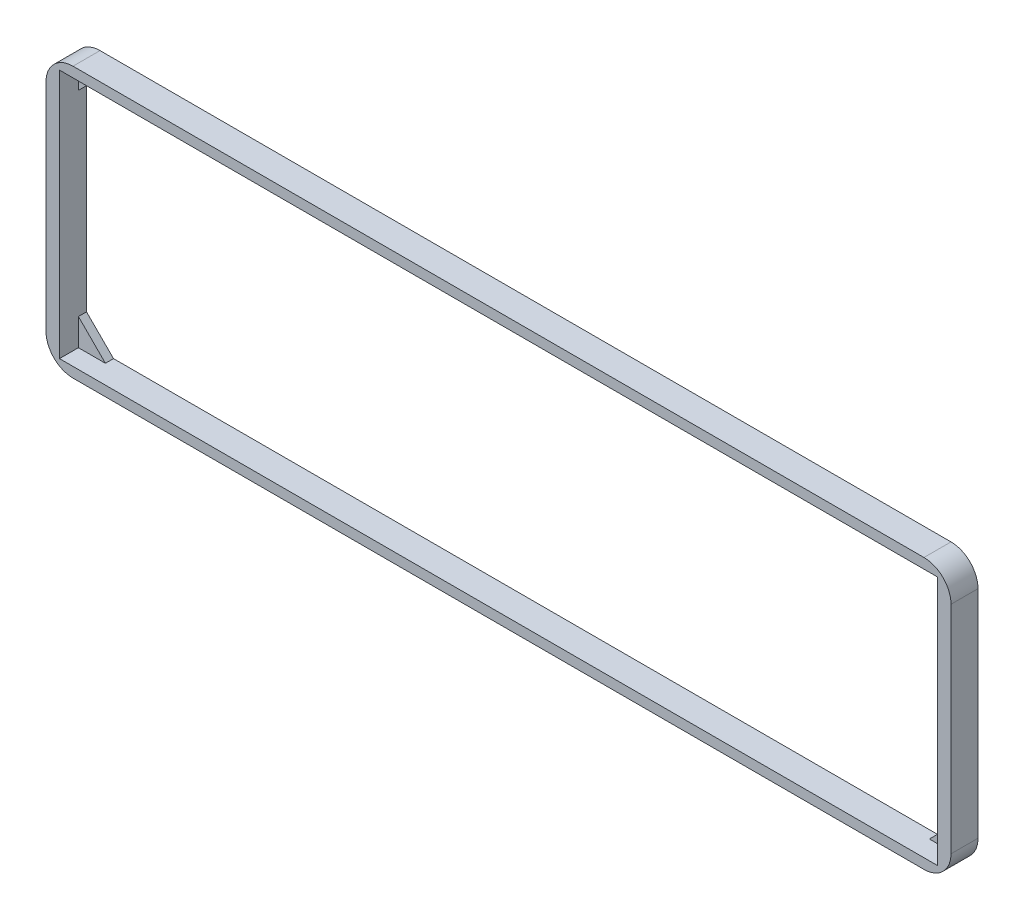
from build123d import *

# Parameters (mm, degrees)
SKETCH1_W           = 335
SKETCH1_H           = 100
SKETCH1_W_2         = 325
SKETCH1_H_2         = 92.5
BOSS_EXTRUDE1_DEPTH = 10
FILLET1_R           = 10
BOSS_EXTRUDE2_DEPTH = 3


with BuildPart() as part:
    # Sketch1 → Boss-Extrude1 (new body)
    with BuildSketch(Plane.XY):
        Rectangle(SKETCH1_W, SKETCH1_H)
        Rectangle(SKETCH1_W_2, SKETCH1_H_2, mode=Mode.SUBTRACT)
    extrude(amount=-BOSS_EXTRUDE1_DEPTH)

    # Fillet1
    fillet1_edges = [part.edges().sort_by_distance(p)[0] for p in [
        (167.5, -50, -5),
        (-167.5, -50, -5),
        (-167.5, 50, -5),
        (167.5, 50, -5),
    ]]
    fillet(fillet1_edges, radius=FILLET1_R)

    # Sketch2 → Boss-Extrude2 (add)
    with BuildSketch(Plane(origin=(0, 0, -10), x_dir=(-1, 0, 0), z_dir=(0, 0, -1))):
        Polygon((-162.5, -46.25), (-162.5, -36.25), (-152.5, -46.25), align=None)
        Polygon((-162.5, 46.25), (-152.5, 46.25), (-162.5, 36.25), align=None)
        Polygon((162.5, 46.25), (152.5, 46.25), (162.5, 36.25), align=None)
        Polygon((162.5, -46.25), (162.5, -36.25), (152.5, -46.25), align=None)
    extrude(amount=-BOSS_EXTRUDE2_DEPTH)


solid = part.part
